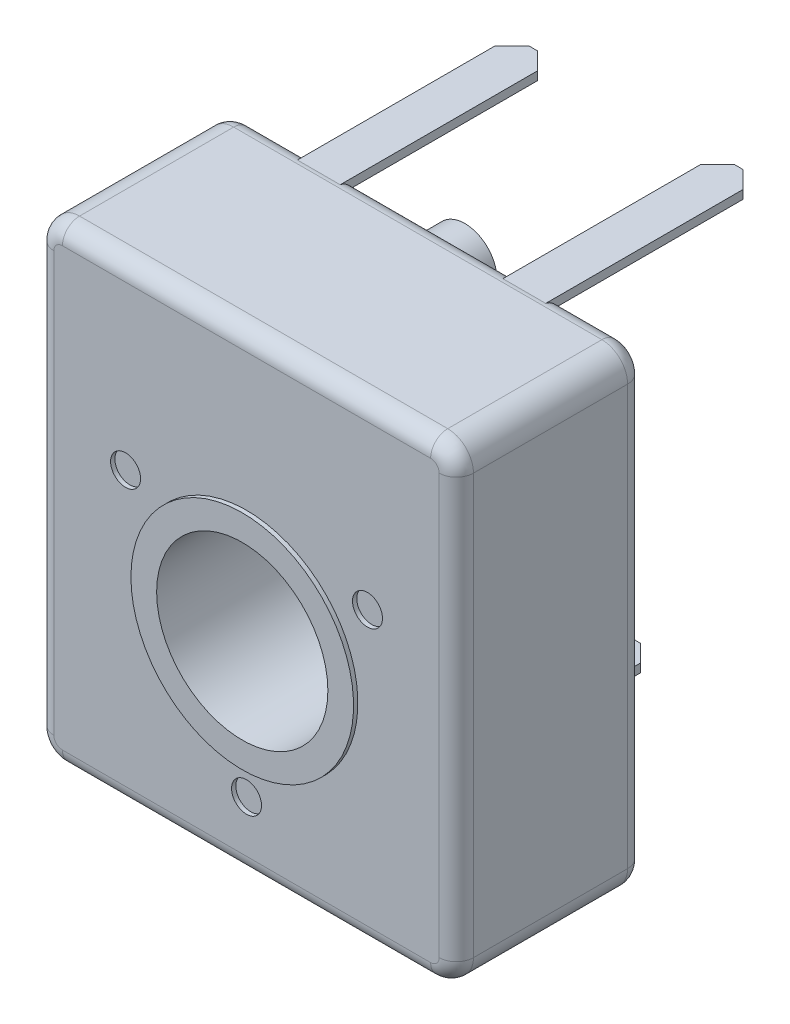
from build123d import *

# Parameters (mm, degrees)
SKETCH1_W                         = 9.8
SKETCH1_H                         = 11
BOSS_EXTRUDE1_BODY_DEPTH          = 2.2
FILLET1_BODYCORNERS_R             = 0.6
FILLET2_BODYFACES_R               = 0.4
CUT_EXTRUDE2_BASEINDENT_START     = -2.2
CUT_EXTRUDE2_BASEINDENT_DEPTH     = 0.1
BOSS_EXTRUDE4_BASESTUDS_START     = -2.1
SKETCH5_R                         = 0.75
SKETCH5_R_2                       = 0.45
SKETCH5_R_3                       = 0.4
BOSS_EXTRUDE4_BASESTUDS_DEPTH     = 0.8
BOSS_EXTRUDE5_PINS_DEPTH          = 2.2
BOSS_EXTRUDE5_PINS_DEPTH_BACK     = 4.8
BOSS_EXTRUDE5_PINS_START          = -2.1
SKETCH6_W                         = 1
SKETCH6_H                         = 0.2
CHAMFER2_PINS_SIZE                = 0.4
BOSS_EXTRUDE6_KNOBEDGE_START      = -2.2
SKETCH7_R                         = 2.6
SKETCH7_R_2                       = 2
BOSS_EXTRUDE6_KNOBEDGE_DEPTH      = 4.5
CUT_EXTRUDE3_SHAFTHOLE_DEPTH      = 17.26806688
CUT_EXTRUDE3_SHAFTHOLE_DEPTH_BACK = 15.16806688
CUT_EXTRUDE3_SHAFTHOLE_START      = -2.1
SKETCH8_R                         = 2
CUT_EXTRUDE4_DETAIL_START         = 2.2
SKETCH9_R                         = 0.35
CUT_EXTRUDE4_DETAIL_DEPTH         = 0.1


with BuildPart() as part:
    # Sketch1 → Boss-Extrude1_Body (new, symmetric)
    with BuildSketch(Plane.XY):
        with Locations((-4.9, -5.5)):
            Rectangle(SKETCH1_W, SKETCH1_H)
    extrude(amount=BOSS_EXTRUDE1_BODY_DEPTH, both=True)

    # Fillet1_BodyCorners
    fillet1_bodycorners_edges = [part.edges().sort_by_distance(p)[0] for p in [
        (0, -11, 0),
        (-9.8, -11, 0),
        (-9.8, 0, 0),
        (0, 0, 0),
    ]]
    fillet(fillet1_bodycorners_edges, radius=FILLET1_BODYCORNERS_R)

    # Fillet2_BodyFaces
    fillet2_bodyfaces_edges = [part.edges().sort_by_distance(p)[0] for p in [
        (-9.8, -5.5, -2.2),
        (-9.8, -5.5, 2.2),
        (0, -5.5, -2.2),
        (-4.9, -11, -2.2),
        (-4.9, 0, -2.2),
        (-0.175735931, -0.175735931, -2.2),
        (-0.175735931, -10.824264069, -2.2),
        (-9.624264069, -10.824264069, -2.2),
        (-9.624264069, -0.175735931, -2.2),
        (-4.9, 0, 2.2),
        (0, -5.5, 2.2),
        (-4.9, -11, 2.2),
        (-0.175735931, -0.175735931, 2.2),
        (-0.175735931, -10.824264069, 2.2),
        (-9.624264069, -10.824264069, 2.2),
        (-9.624264069, -0.175735931, 2.2),
    ]]
    fillet(fillet2_bodyfaces_edges, radius=FILLET2_BODYFACES_R)

    # Sketch4 → Cut-Extrude2_BaseIndent (cut)
    with BuildSketch(Plane.XY.offset(CUT_EXTRUDE2_BASEINDENT_START)):
        with BuildLine():
            Line((-0.6, -0.4), (-9.2, -0.4))
            ThreePointArc((-9.2, -0.4), (-9.341421356, -0.458578644), (-9.4, -0.6))
            Line((-9.4, -0.6), (-9.4, -10.4))
            ThreePointArc((-9.4, -10.4), (-9.341421356, -10.541421356), (-9.2, -10.6))
            Line((-9.2, -10.6), (-0.6, -10.6))
            ThreePointArc((-0.6, -10.6), (-0.458578644, -10.541421356), (-0.4, -10.4))
            Line((-0.4, -10.4), (-0.4, -0.6))
            ThreePointArc((-0.4, -0.6), (-0.458578644, -0.458578644), (-0.6, -0.4))
        make_face()
    extrude(amount=CUT_EXTRUDE2_BASEINDENT_DEPTH, mode=Mode.SUBTRACT)

    # Sketch5 → Boss-Extrude4_BaseStuds (add)
    # profile 1 of 3: a face of its own
    with BuildSketch(Plane.XY.offset(BOSS_EXTRUDE4_BASESTUDS_START)):
        with Locations(Location((-4.9, -1.1, 0), (0, 0, 68.960530219))):
            Circle(SKETCH5_R)
        with Locations(Location((-4.9, -1.1, 0), (0, 0, 180))):
            Circle(SKETCH5_R_2, mode=Mode.SUBTRACT)
    # profile 2 of 3: a face of its own
    with BuildSketch(Plane.XY.offset(BOSS_EXTRUDE4_BASESTUDS_START)):
        with Locations(Location((-1.35, -9.7, 0), (0, 0, 180))):
            Circle(SKETCH5_R_3)
    # profile 3 of 3: a face of its own
    with BuildSketch(Plane.XY.offset(BOSS_EXTRUDE4_BASESTUDS_START)):
        with Locations(Location((-8.45, -9.7, 0), (0, 0, 180))):
            Circle(SKETCH5_R_3)
    extrude(amount=-BOSS_EXTRUDE4_BASESTUDS_DEPTH)

    # Sketch6 → Boss-Extrude5_Pins (add, two sides: drawn at the far end of the back side and taken through both)
    with BuildSketch(Plane.XY.offset(BOSS_EXTRUDE5_PINS_START - BOSS_EXTRUDE5_PINS_DEPTH_BACK)):
        with Locations((-2.5, -0.11)):
            Rectangle(SKETCH6_W, SKETCH6_H)
        with Locations((-7.3, -0.11)):
            Rectangle(SKETCH6_W, SKETCH6_H)
        with Locations((-4.9, -10.89)):
            Rectangle(SKETCH6_W, SKETCH6_H)
    extrude(amount=BOSS_EXTRUDE5_PINS_DEPTH + BOSS_EXTRUDE5_PINS_DEPTH_BACK)

    # Chamfer2_Pins
    chamfer2_pins_edges = [part.edges().sort_by_distance(p)[0] for p in [
        (-2, -0.11, -6.9),
        (-3, -0.11, -6.9),
        (-6.8, -0.11, -6.9),
        (-7.8, -0.11, -6.9),
        (-4.4, -10.89, -6.9),
        (-5.4, -10.89, -6.9),
    ]]
    chamfer(chamfer2_pins_edges, length=CHAMFER2_PINS_SIZE)

    # Sketch7 → Boss-Extrude6_KnobEdge (add)
    with BuildSketch(Plane.XY.offset(BOSS_EXTRUDE6_KNOBEDGE_START)):
        with Locations(Location((-4.9, -6.2, 0), (0, 0, 180))):
            Circle(SKETCH7_R)
        with Locations(Location((-4.9, -6.2, 0), (0, 0, 180))):
            Circle(SKETCH7_R_2, mode=Mode.SUBTRACT)
    extrude(amount=BOSS_EXTRUDE6_KNOBEDGE_DEPTH)

    # Sketch8 → Cut-Extrude3_ShaftHole (cut, two sides: drawn at the far end of the back side and taken through both)
    with BuildSketch(Plane.XY.offset(CUT_EXTRUDE3_SHAFTHOLE_START - CUT_EXTRUDE3_SHAFTHOLE_DEPTH_BACK)):
        with Locations(Location((-4.9, -6.2, 0), (0, 0, 180))):
            Circle(SKETCH8_R)
    extrude(amount=CUT_EXTRUDE3_SHAFTHOLE_DEPTH + CUT_EXTRUDE3_SHAFTHOLE_DEPTH_BACK, mode=Mode.SUBTRACT)

    # Sketch9 → Cut-Extrude4_Detail (cut)
    with BuildSketch(Plane.XY.offset(CUT_EXTRUDE4_DETAIL_START)):
        with Locations(Location((-7.725, -4.2, 0), (0, 0, 180))):
            Circle(SKETCH9_R)
        with Locations(Location((-2.075, -4.2, 0), (0, 0, 180))):
            Circle(SKETCH9_R)
        with Locations(Location((-4.9, -9.4, 0), (0, 0, 180))):
            Circle(SKETCH9_R)
    extrude(amount=-CUT_EXTRUDE4_DETAIL_DEPTH, mode=Mode.SUBTRACT)


solid = part.part
